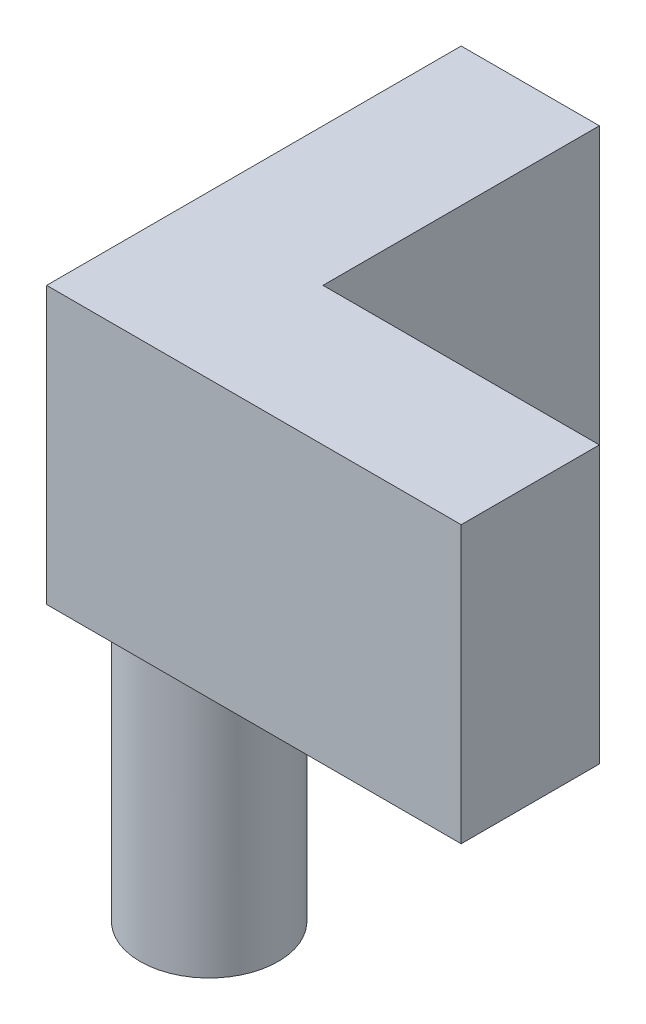
from build123d import *

# Parameters (mm, degrees)
SKETCH1_R           = 2.5
BOSS_EXTRUDE1_DEPTH = 10
BOSS_EXTRUDE2_START = -20
SKETCH2_R           = 2.5
BOSS_EXTRUDE2_DEPTH = 20


with BuildPart() as part:
    # Sketch1 → Boss-Extrude1 (new body)
    with BuildSketch(Plane(origin=(0, 0, 0), x_dir=(1, 0, 0), z_dir=(0, 1, 0))):
        Polygon((0, 15), (0, 0), (15, 0), (15, 5), (5, 5), (5, 15), align=None)
        with Locations(Location((2.879948547, 3.000793191, 0), (0, 0, 270))):
            Circle(SKETCH1_R, mode=Mode.SUBTRACT)
    extrude(amount=BOSS_EXTRUDE1_DEPTH)

    # Sketch2 → Boss-Extrude2 (add)
    with BuildSketch(Plane(origin=(0, 10, 0), x_dir=(1, 0, 0), z_dir=(0, 1, 0)).offset(BOSS_EXTRUDE2_START)):
        with Locations(Location((2.879948547, 3.000793191, 0), (0, 0, 270))):
            Circle(SKETCH2_R)
    extrude(amount=BOSS_EXTRUDE2_DEPTH)


solid = part.part
